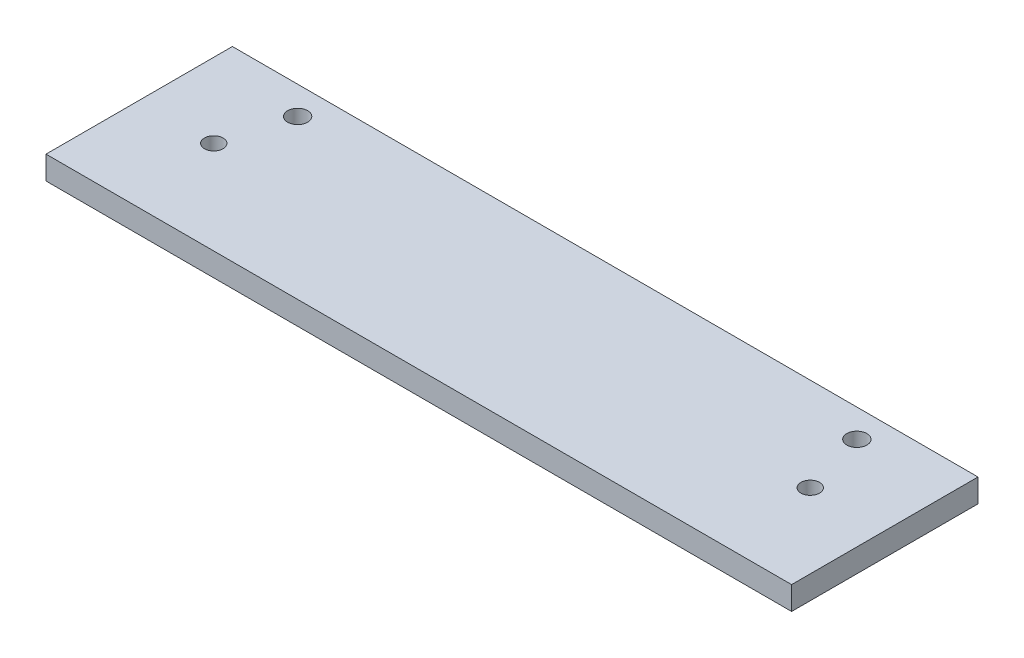
from build123d import *

# Parameters (mm, degrees)
SK_PLATE_W              = 160
SK_PLATE_H              = 40
EX_PLATE_DEPTH          = 5
SK_PADPOCKETS_W         = 26
SK_PADPOCKETS_H         = 20
CUT_PADPOCKETS_DEPTH    = 1
SK_PADINSERTS_M3_R      = 2
CUT_PADINSERTS_M3_DEPTH = 5
SK_MAGNET_R             = 3
CUT_MAGNET_DEPTH        = 3
SK_FRAMEBOLTS_R         = 2.15
CUT_FRAMEBOLTS_DEPTH    = 5


with BuildPart() as part:
    # SK_Plate → EX_Plate (new body)
    with BuildSketch(Plane(origin=(0, 0, 0), x_dir=(1, 0, 0), z_dir=(0, 1, 0))):
        Rectangle(SK_PLATE_W, SK_PLATE_H)
    extrude(amount=EX_PLATE_DEPTH)

    # SK_PadPockets → CUT_PadPockets (cut)
    with BuildSketch(Plane(origin=(0, 0, 0), x_dir=(1, 0, 0), z_dir=(0, 1, 0))):
        with Locations((64, 0)):
            Rectangle(SK_PADPOCKETS_W, SK_PADPOCKETS_H)
        with Locations((-64, 0)):
            Rectangle(SK_PADPOCKETS_W, SK_PADPOCKETS_H)
    extrude(amount=CUT_PADPOCKETS_DEPTH, mode=Mode.SUBTRACT)

    # SK_PadInserts_M3 → CUT_PadInserts_M3 (cut)
    with BuildSketch(Plane(origin=(0, 0, 0), x_dir=(1, 0, 0), z_dir=(0, 1, 0))):
        with Locations((64, 0)):
            Circle(SK_PADINSERTS_M3_R)
        with Locations((-64, 0)):
            Circle(SK_PADINSERTS_M3_R)
    extrude(amount=CUT_PADINSERTS_M3_DEPTH, mode=Mode.SUBTRACT)

    # SK_Magnet → CUT_Magnet (cut)
    with BuildSketch(Plane(origin=(0, 0, 0), x_dir=(1, 0, 0), z_dir=(0, 1, 0))):
        Circle(SK_MAGNET_R)
    extrude(amount=CUT_MAGNET_DEPTH, mode=Mode.SUBTRACT)

    # SK_FrameBolts → CUT_FrameBolts (cut)
    with BuildSketch(Plane(origin=(0, 0, 0), x_dir=(1, 0, 0), z_dir=(0, 1, 0))):
        with Locations((60, 14)):
            Circle(SK_FRAMEBOLTS_R)
        with Locations((-60, 14)):
            Circle(SK_FRAMEBOLTS_R)
    extrude(amount=CUT_FRAMEBOLTS_DEPTH, mode=Mode.SUBTRACT)


solid = part.part
